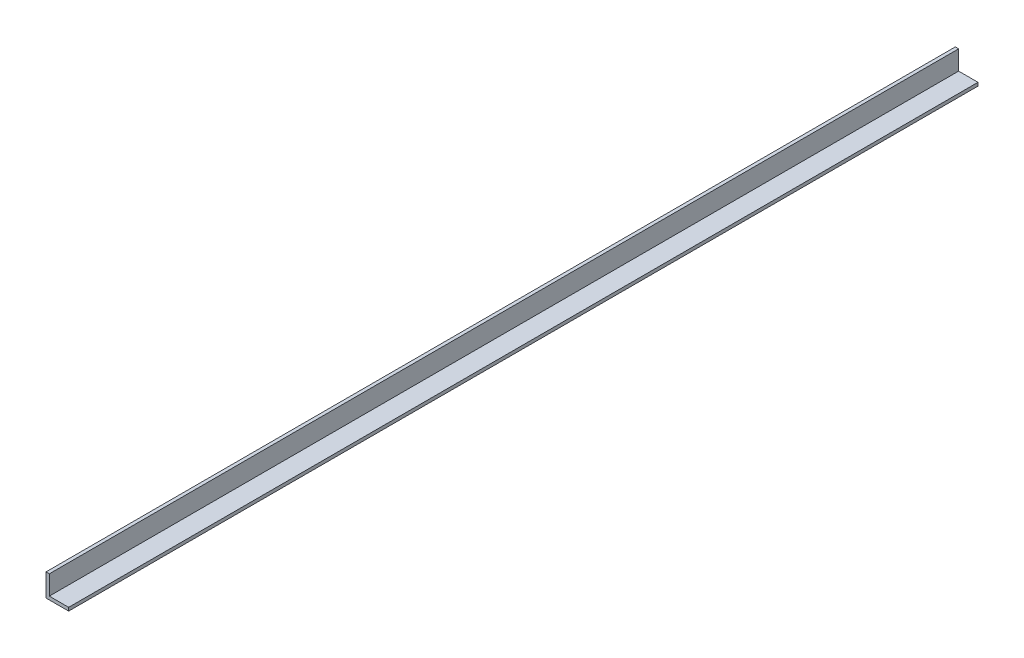
from build123d import *

# Parameters (mm, degrees)
SALIENTE_EXTRUIR1_DEPTH = 6100


with BuildPart() as part:
    # Croquis1 → Saliente-Extruir1 (new body)
    with BuildSketch(Plane.XY):
        Polygon((0, 152), (0, 0), (152, 0), (152, 22.23), (22.23, 22.23), (22.23, 152), align=None)
    extrude(amount=-SALIENTE_EXTRUIR1_DEPTH)


solid = part.part
